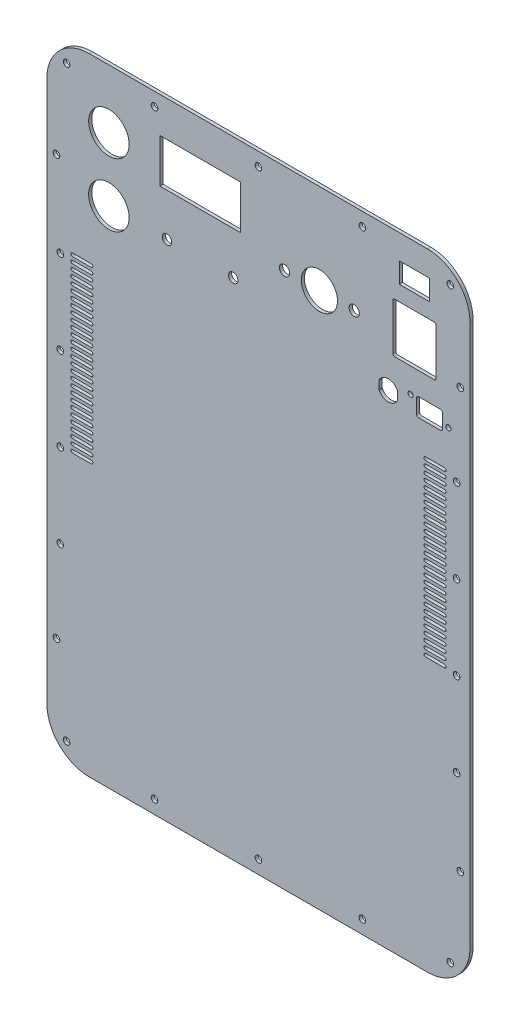
from build123d import *

# Parameters (mm, degrees)
SALIENTE_EXTRUIR1_DEPTH = 2
CROQUIS2_R              = 12.85
CROQUIS2_R_2            = 3
CROQUIS2_R_3            = 11.5
CROQUIS2_R_4            = 3.25
CROQUIS2_R_5            = 1.625
CROQUIS2_W              = 51.3
CROQUIS2_H              = 27.8
CROQUIS2_W_2            = 19.3
CROQUIS2_H_2            = 12.9
CORTAR_EXTRUIR1_DEPTH   = 240.926161819
CROQUIS3_R              = 2.095
CORTAR_EXTRUIR2_DEPTH   = 240.926161819
CORTAR_EXTRUIR3_DEPTH   = 240.926161819


with BuildPart() as part:
    # Croquis1 → Saliente-Extruir1 (new body)
    with BuildSketch(Plane.XY):
        with BuildLine():
            Line((-107.295, -198.81), (107.295, -198.81))
            ThreePointArc((107.295, -198.81), (126.386883092, -190.901883092), (134.295, -171.81))
            Line((134.295, -171.81), (134.295, 171.81))
            ThreePointArc((134.295, 171.81), (126.386883092, 190.901883092), (107.295, 198.81))
            Line((107.295, 198.81), (-107.295, 198.81))
            ThreePointArc((-107.295, 198.81), (-126.386883092, 190.901883092), (-134.295, 171.81))
            Line((-134.295, 171.81), (-134.295, -171.81))
            ThreePointArc((-134.295, -171.81), (-126.386883092, -190.901883092), (-107.295, -198.81))
        make_face()
    extrude(amount=SALIENTE_EXTRUIR1_DEPTH)

    # Croquis2 → Cortar-Extruir1 (cut, through all)
    with BuildSketch(Plane.XY.offset(2)):
        with Locations((-94.915, 161.54)):
            Circle(CROQUIS2_R)
        with Locations((-94.915, 121.27)):
            Circle(CROQUIS2_R)
        with Locations((-58.015, 121.27)):
            Circle(CROQUIS2_R_2)
        with Locations((-16.015, 121.27)):
            Circle(CROQUIS2_R_2)
        with Locations((38.695, 141.62)):
            Circle(CROQUIS2_R_3)
        with Locations((16.595, 141.62)):
            Circle(CROQUIS2_R_4)
        with Locations((60.795, 141.62)):
            Circle(CROQUIS2_R_4)
        with Locations((120.565, 107.09)):
            Circle(CROQUIS2_R_5)
        with Locations((96.565, 113.44)):
            Circle(CROQUIS2_R_5)
        with Locations((-36.965, 162.29)):
            Rectangle(CROQUIS2_W, CROQUIS2_H)
        with Locations((99.035, 176.84)):
            Rectangle(CROQUIS2_W_2, CROQUIS2_H_2)
        with BuildLine():
            Line((86.385, 129.09), (111.685, 129.09))
            ThreePointArc((111.685, 129.09), (112.392106781, 129.382893219), (112.685, 130.09))
            Line((112.685, 130.09), (112.685, 159.69))
            ThreePointArc((112.685, 159.69), (112.392106781, 160.397106781), (111.685, 160.69))
            Line((111.685, 160.69), (86.385, 160.69))
            ThreePointArc((86.385, 160.69), (85.677893219, 160.397106781), (85.385, 159.69))
            Line((85.385, 159.69), (85.385, 130.09))
            ThreePointArc((85.385, 130.09), (85.677893219, 129.382893219), (86.385, 129.09))
        make_face()
        with BuildLine():
            Line((101.67, 103.165), (115.46, 103.165))
            ThreePointArc((115.46, 103.165), (116.435807358, 103.569192642), (116.84, 104.545))
            Line((116.84, 104.545), (116.84, 113.335))
            ThreePointArc((116.84, 113.335), (116.435807358, 114.310807358), (115.46, 114.715))
            Line((115.46, 114.715), (101.67, 114.715))
            ThreePointArc((101.67, 114.715), (100.694192642, 114.310807358), (100.29, 113.335))
            Line((100.29, 113.335), (100.29, 104.545))
            ThreePointArc((100.29, 104.545), (100.694192642, 103.569192642), (101.67, 103.165))
        make_face()
        with BuildLine():
            Line((76.59, 105.938703148), (76.59, 111.241296852))
            ThreePointArc((76.59, 111.241296852), (82.415, 114.99), (88.24, 111.241296852))
            Line((88.24, 111.241296852), (88.24, 105.938703148))
            ThreePointArc((88.24, 105.938703148), (82.415, 102.19), (76.59, 105.938703148))
        make_face()
    extrude(amount=-CORTAR_EXTRUIR1_DEPTH, mode=Mode.SUBTRACT)

    # Croquis3 → Cortar-Extruir2 (cut, through all)
    with BuildSketch(Plane.XY.offset(2)):
        with Locations((0, 190.26)):
            Circle(CROQUIS3_R)
        with Locations((-65.96, 190.26)):
            Circle(CROQUIS3_R)
        with Locations((-121.78, 186.3)):
            Circle(CROQUIS3_R)
        with Locations(Location((65.96, 190.26, 0), (0, 0, 180))):
            Circle(CROQUIS3_R)
        with Locations(Location((121.78, 186.3, 0), (0, 0, 180))):
            Circle(CROQUIS3_R)
        with Locations((121.78, -186.3)):
            Circle(CROQUIS3_R)
        with Locations((65.96, -190.26)):
            Circle(CROQUIS3_R)
        with Locations(Location((0, -190.26, 0), (0, 0, 180))):
            Circle(CROQUIS3_R)
        with Locations(Location((-65.96, -190.26, 0), (0, 0, 180))):
            Circle(CROQUIS3_R)
        with Locations(Location((-121.78, -186.3, 0), (0, 0, 180))):
            Circle(CROQUIS3_R)
        with Locations((-125.745, 26.61)):
            Circle(CROQUIS3_R)
        with Locations((-125.745, 79.83)):
            Circle(CROQUIS3_R)
        with Locations((-128.165, 133.05)):
            Circle(CROQUIS3_R)
        with Locations(Location((-125.745, -26.61, 0), (0, 0, 180))):
            Circle(CROQUIS3_R)
        with Locations(Location((-125.745, -79.83, 0), (0, 0, 180))):
            Circle(CROQUIS3_R)
        with Locations(Location((-128.165, -133.05, 0), (0, 0, 180))):
            Circle(CROQUIS3_R)
        with Locations((128.165, -133.05)):
            Circle(CROQUIS3_R)
        with Locations((125.745, -79.83)):
            Circle(CROQUIS3_R)
        with Locations((125.745, -26.61)):
            Circle(CROQUIS3_R)
        with Locations(Location((125.745, 26.61, 0), (0, 0, 180))):
            Circle(CROQUIS3_R)
        with Locations(Location((125.745, 79.83, 0), (0, 0, 180))):
            Circle(CROQUIS3_R)
        with Locations(Location((128.165, 133.05, 0), (0, 0, 180))):
            Circle(CROQUIS3_R)
    extrude(amount=-CORTAR_EXTRUIR2_DEPTH, mode=Mode.SUBTRACT)

    # Croquis4 → Cortar-Extruir3 (cut, through all)
    with BuildSketch(Plane.XY.offset(2)):
        with BuildLine():
            Line((-118.065, 83.89), (-106.065, 83.89))
            ThreePointArc((-106.065, 83.89), (-105.065, 82.89), (-106.065, 81.89))
            Line((-106.065, 81.89), (-118.065, 81.89))
            ThreePointArc((-118.065, 81.89), (-119.065, 82.89), (-118.065, 83.89))
        make_face()
        with BuildLine():
            Line((-118.065, 79.89), (-106.065, 79.89))
            ThreePointArc((-106.065, 79.89), (-105.065, 78.89), (-106.065, 77.89))
            Line((-106.065, 77.89), (-118.065, 77.89))
            ThreePointArc((-118.065, 77.89), (-119.065, 78.89), (-118.065, 79.89))
        make_face()
        with BuildLine():
            Line((-118.065, 75.89), (-106.065, 75.89))
            ThreePointArc((-106.065, 75.89), (-105.065, 74.89), (-106.065, 73.89))
            Line((-106.065, 73.89), (-118.065, 73.89))
            ThreePointArc((-118.065, 73.89), (-119.065, 74.89), (-118.065, 75.89))
        make_face()
        with BuildLine():
            Line((-118.065, 71.89), (-106.065, 71.89))
            ThreePointArc((-106.065, 71.89), (-105.065, 70.89), (-106.065, 69.89))
            Line((-106.065, 69.89), (-118.065, 69.89))
            ThreePointArc((-118.065, 69.89), (-119.065, 70.89), (-118.065, 71.89))
        make_face()
        with BuildLine():
            Line((-118.065, 67.89), (-106.065, 67.89))
            ThreePointArc((-106.065, 67.89), (-105.065, 66.89), (-106.065, 65.89))
            Line((-106.065, 65.89), (-118.065, 65.89))
            ThreePointArc((-118.065, 65.89), (-119.065, 66.89), (-118.065, 67.89))
        make_face()
        with BuildLine():
            Line((-118.065, 63.89), (-106.065, 63.89))
            ThreePointArc((-106.065, 63.89), (-105.065, 62.89), (-106.065, 61.89))
            Line((-106.065, 61.89), (-118.065, 61.89))
            ThreePointArc((-118.065, 61.89), (-119.065, 62.89), (-118.065, 63.89))
        make_face()
        with BuildLine():
            Line((-118.065, 59.89), (-106.065, 59.89))
            ThreePointArc((-106.065, 59.89), (-105.065, 58.89), (-106.065, 57.89))
            Line((-106.065, 57.89), (-118.065, 57.89))
            ThreePointArc((-118.065, 57.89), (-119.065, 58.89), (-118.065, 59.89))
        make_face()
        with BuildLine():
            Line((-118.065, 55.89), (-106.065, 55.89))
            ThreePointArc((-106.065, 55.89), (-105.065, 54.89), (-106.065, 53.89))
            Line((-106.065, 53.89), (-118.065, 53.89))
            ThreePointArc((-118.065, 53.89), (-119.065, 54.89), (-118.065, 55.89))
        make_face()
        with BuildLine():
            Line((-118.065, 51.89), (-106.065, 51.89))
            ThreePointArc((-106.065, 51.89), (-105.065, 50.89), (-106.065, 49.89))
            Line((-106.065, 49.89), (-118.065, 49.89))
            ThreePointArc((-118.065, 49.89), (-119.065, 50.89), (-118.065, 51.89))
        make_face()
        with BuildLine():
            Line((-118.065, 47.89), (-106.065, 47.89))
            ThreePointArc((-106.065, 47.89), (-105.065, 46.89), (-106.065, 45.89))
            Line((-106.065, 45.89), (-118.065, 45.89))
            ThreePointArc((-118.065, 45.89), (-119.065, 46.89), (-118.065, 47.89))
        make_face()
        with BuildLine():
            Line((-118.065, 43.89), (-106.065, 43.89))
            ThreePointArc((-106.065, 43.89), (-105.065, 42.89), (-106.065, 41.89))
            Line((-106.065, 41.89), (-118.065, 41.89))
            ThreePointArc((-118.065, 41.89), (-119.065, 42.89), (-118.065, 43.89))
        make_face()
        with BuildLine():
            Line((-118.065, 39.89), (-106.065, 39.89))
            ThreePointArc((-106.065, 39.89), (-105.065, 38.89), (-106.065, 37.89))
            Line((-106.065, 37.89), (-118.065, 37.89))
            ThreePointArc((-118.065, 37.89), (-119.065, 38.89), (-118.065, 39.89))
        make_face()
        with BuildLine():
            Line((-118.065, 35.89), (-106.065, 35.89))
            ThreePointArc((-106.065, 35.89), (-105.065, 34.89), (-106.065, 33.89))
            Line((-106.065, 33.89), (-118.065, 33.89))
            ThreePointArc((-118.065, 33.89), (-119.065, 34.89), (-118.065, 35.89))
        make_face()
        with BuildLine():
            Line((-118.065, 31.89), (-106.065, 31.89))
            ThreePointArc((-106.065, 31.89), (-105.065, 30.89), (-106.065, 29.89))
            Line((-106.065, 29.89), (-118.065, 29.89))
            ThreePointArc((-118.065, 29.89), (-119.065, 30.89), (-118.065, 31.89))
        make_face()
        with BuildLine():
            Line((-118.065, 27.89), (-106.065, 27.89))
            ThreePointArc((-106.065, 27.89), (-105.065, 26.89), (-106.065, 25.89))
            Line((-106.065, 25.89), (-118.065, 25.89))
            ThreePointArc((-118.065, 25.89), (-119.065, 26.89), (-118.065, 27.89))
        make_face()
        with BuildLine():
            Line((-118.065, 23.89), (-106.065, 23.89))
            ThreePointArc((-106.065, 23.89), (-105.065, 22.89), (-106.065, 21.89))
            Line((-106.065, 21.89), (-118.065, 21.89))
            ThreePointArc((-118.065, 21.89), (-119.065, 22.89), (-118.065, 23.89))
        make_face()
        with BuildLine():
            Line((-118.065, 19.89), (-106.065, 19.89))
            ThreePointArc((-106.065, 19.89), (-105.065, 18.89), (-106.065, 17.89))
            Line((-106.065, 17.89), (-118.065, 17.89))
            ThreePointArc((-118.065, 17.89), (-119.065, 18.89), (-118.065, 19.89))
        make_face()
        with BuildLine():
            Line((-118.065, 15.89), (-106.065, 15.89))
            ThreePointArc((-106.065, 15.89), (-105.065, 14.89), (-106.065, 13.89))
            Line((-106.065, 13.89), (-118.065, 13.89))
            ThreePointArc((-118.065, 13.89), (-119.065, 14.89), (-118.065, 15.89))
        make_face()
        with BuildLine():
            Line((-118.065, 11.89), (-106.065, 11.89))
            ThreePointArc((-106.065, 11.89), (-105.065, 10.89), (-106.065, 9.89))
            Line((-106.065, 9.89), (-118.065, 9.89))
            ThreePointArc((-118.065, 9.89), (-119.065, 10.89), (-118.065, 11.89))
        make_face()
        with BuildLine():
            Line((-118.065, 7.89), (-106.065, 7.89))
            ThreePointArc((-106.065, 7.89), (-105.065, 6.89), (-106.065, 5.89))
            Line((-106.065, 5.89), (-118.065, 5.89))
            ThreePointArc((-118.065, 5.89), (-119.065, 6.89), (-118.065, 7.89))
        make_face()
        with BuildLine():
            Line((-118.065, 3.89), (-106.065, 3.89))
            ThreePointArc((-106.065, 3.89), (-105.065, 2.89), (-106.065, 1.89))
            Line((-106.065, 1.89), (-118.065, 1.89))
            ThreePointArc((-118.065, 1.89), (-119.065, 2.89), (-118.065, 3.89))
        make_face()
        with BuildLine():
            Line((-118.065, -0.11), (-106.065, -0.11))
            ThreePointArc((-106.065, -0.11), (-105.065, -1.11), (-106.065, -2.11))
            Line((-106.065, -2.11), (-118.065, -2.11))
            ThreePointArc((-118.065, -2.11), (-119.065, -1.11), (-118.065, -0.11))
        make_face()
        with BuildLine():
            Line((-118.065, -4.11), (-106.065, -4.11))
            ThreePointArc((-106.065, -4.11), (-105.065, -5.11), (-106.065, -6.11))
            Line((-106.065, -6.11), (-118.065, -6.11))
            ThreePointArc((-118.065, -6.11), (-119.065, -5.11), (-118.065, -4.11))
        make_face()
        with BuildLine():
            Line((-118.065, -8.11), (-106.065, -8.11))
            ThreePointArc((-106.065, -8.11), (-105.065, -9.11), (-106.065, -10.11))
            Line((-106.065, -10.11), (-118.065, -10.11))
            ThreePointArc((-118.065, -10.11), (-119.065, -9.11), (-118.065, -8.11))
        make_face()
        with BuildLine():
            Line((-118.065, -12.11), (-106.065, -12.11))
            ThreePointArc((-106.065, -12.11), (-105.065, -13.11), (-106.065, -14.11))
            Line((-106.065, -14.11), (-118.065, -14.11))
            ThreePointArc((-118.065, -14.11), (-119.065, -13.11), (-118.065, -12.11))
        make_face()
        with BuildLine():
            Line((-118.065, -16.11), (-106.065, -16.11))
            ThreePointArc((-106.065, -16.11), (-105.065, -17.11), (-106.065, -18.11))
            Line((-106.065, -18.11), (-118.065, -18.11))
            ThreePointArc((-118.065, -18.11), (-119.065, -17.11), (-118.065, -16.11))
        make_face()
        with BuildLine():
            Line((-118.065, -20.11), (-106.065, -20.11))
            ThreePointArc((-106.065, -20.11), (-105.065, -21.11), (-106.065, -22.11))
            Line((-106.065, -22.11), (-118.065, -22.11))
            ThreePointArc((-118.065, -22.11), (-119.065, -21.11), (-118.065, -20.11))
        make_face()
        with BuildLine():
            Line((-118.065, -24.11), (-106.065, -24.11))
            ThreePointArc((-106.065, -24.11), (-105.065, -25.11), (-106.065, -26.11))
            Line((-106.065, -26.11), (-118.065, -26.11))
            ThreePointArc((-118.065, -26.11), (-119.065, -25.11), (-118.065, -24.11))
        make_face()
        with BuildLine():
            Line((-150.525, 83.89), (-162.525, 83.89))
            ThreePointArc((-162.525, 83.89), (-163.525, 82.89), (-162.525, 81.89))
            Line((-162.525, 81.89), (-150.525, 81.89))
            ThreePointArc((-150.525, 81.89), (-149.525, 82.89), (-150.525, 83.89))
        make_face()
        with BuildLine():
            Line((118.065, -24.11), (106.065, -24.11))
            ThreePointArc((106.065, -24.11), (105.065, -25.11), (106.065, -26.11))
            Line((106.065, -26.11), (118.065, -26.11))
            ThreePointArc((118.065, -26.11), (119.065, -25.11), (118.065, -24.11))
        make_face()
        with BuildLine():
            Line((118.065, -20.11), (106.065, -20.11))
            ThreePointArc((106.065, -20.11), (105.065, -21.11), (106.065, -22.11))
            Line((106.065, -22.11), (118.065, -22.11))
            ThreePointArc((118.065, -22.11), (119.065, -21.11), (118.065, -20.11))
        make_face()
        with BuildLine():
            Line((118.065, -16.11), (106.065, -16.11))
            ThreePointArc((106.065, -16.11), (105.065, -17.11), (106.065, -18.11))
            Line((106.065, -18.11), (118.065, -18.11))
            ThreePointArc((118.065, -18.11), (119.065, -17.11), (118.065, -16.11))
        make_face()
        with BuildLine():
            Line((118.065, -12.11), (106.065, -12.11))
            ThreePointArc((106.065, -12.11), (105.065, -13.11), (106.065, -14.11))
            Line((106.065, -14.11), (118.065, -14.11))
            ThreePointArc((118.065, -14.11), (119.065, -13.11), (118.065, -12.11))
        make_face()
        with BuildLine():
            Line((118.065, -8.11), (106.065, -8.11))
            ThreePointArc((106.065, -8.11), (105.065, -9.11), (106.065, -10.11))
            Line((106.065, -10.11), (118.065, -10.11))
            ThreePointArc((118.065, -10.11), (119.065, -9.11), (118.065, -8.11))
        make_face()
        with BuildLine():
            Line((118.065, -4.11), (106.065, -4.11))
            ThreePointArc((106.065, -4.11), (105.065, -5.11), (106.065, -6.11))
            Line((106.065, -6.11), (118.065, -6.11))
            ThreePointArc((118.065, -6.11), (119.065, -5.11), (118.065, -4.11))
        make_face()
        with BuildLine():
            Line((118.065, -0.11), (106.065, -0.11))
            ThreePointArc((106.065, -0.11), (105.065, -1.11), (106.065, -2.11))
            Line((106.065, -2.11), (118.065, -2.11))
            ThreePointArc((118.065, -2.11), (119.065, -1.11), (118.065, -0.11))
        make_face()
        with BuildLine():
            Line((118.065, 3.89), (106.065, 3.89))
            ThreePointArc((106.065, 3.89), (105.065, 2.89), (106.065, 1.89))
            Line((106.065, 1.89), (118.065, 1.89))
            ThreePointArc((118.065, 1.89), (119.065, 2.89), (118.065, 3.89))
        make_face()
        with BuildLine():
            Line((118.065, 7.89), (106.065, 7.89))
            ThreePointArc((106.065, 7.89), (105.065, 6.89), (106.065, 5.89))
            Line((106.065, 5.89), (118.065, 5.89))
            ThreePointArc((118.065, 5.89), (119.065, 6.89), (118.065, 7.89))
        make_face()
        with BuildLine():
            Line((118.065, 11.89), (106.065, 11.89))
            ThreePointArc((106.065, 11.89), (105.065, 10.89), (106.065, 9.89))
            Line((106.065, 9.89), (118.065, 9.89))
            ThreePointArc((118.065, 9.89), (119.065, 10.89), (118.065, 11.89))
        make_face()
        with BuildLine():
            Line((118.065, 15.89), (106.065, 15.89))
            ThreePointArc((106.065, 15.89), (105.065, 14.89), (106.065, 13.89))
            Line((106.065, 13.89), (118.065, 13.89))
            ThreePointArc((118.065, 13.89), (119.065, 14.89), (118.065, 15.89))
        make_face()
        with BuildLine():
            Line((118.065, 19.89), (106.065, 19.89))
            ThreePointArc((106.065, 19.89), (105.065, 18.89), (106.065, 17.89))
            Line((106.065, 17.89), (118.065, 17.89))
            ThreePointArc((118.065, 17.89), (119.065, 18.89), (118.065, 19.89))
        make_face()
        with BuildLine():
            Line((118.065, 23.89), (106.065, 23.89))
            ThreePointArc((106.065, 23.89), (105.065, 22.89), (106.065, 21.89))
            Line((106.065, 21.89), (118.065, 21.89))
            ThreePointArc((118.065, 21.89), (119.065, 22.89), (118.065, 23.89))
        make_face()
        with BuildLine():
            Line((118.065, 27.89), (106.065, 27.89))
            ThreePointArc((106.065, 27.89), (105.065, 26.89), (106.065, 25.89))
            Line((106.065, 25.89), (118.065, 25.89))
            ThreePointArc((118.065, 25.89), (119.065, 26.89), (118.065, 27.89))
        make_face()
        with BuildLine():
            Line((118.065, 31.89), (106.065, 31.89))
            ThreePointArc((106.065, 31.89), (105.065, 30.89), (106.065, 29.89))
            Line((106.065, 29.89), (118.065, 29.89))
            ThreePointArc((118.065, 29.89), (119.065, 30.89), (118.065, 31.89))
        make_face()
        with BuildLine():
            Line((118.065, 35.89), (106.065, 35.89))
            ThreePointArc((106.065, 35.89), (105.065, 34.89), (106.065, 33.89))
            Line((106.065, 33.89), (118.065, 33.89))
            ThreePointArc((118.065, 33.89), (119.065, 34.89), (118.065, 35.89))
        make_face()
        with BuildLine():
            Line((118.065, 39.89), (106.065, 39.89))
            ThreePointArc((106.065, 39.89), (105.065, 38.89), (106.065, 37.89))
            Line((106.065, 37.89), (118.065, 37.89))
            ThreePointArc((118.065, 37.89), (119.065, 38.89), (118.065, 39.89))
        make_face()
        with BuildLine():
            Line((118.065, 43.89), (106.065, 43.89))
            ThreePointArc((106.065, 43.89), (105.065, 42.89), (106.065, 41.89))
            Line((106.065, 41.89), (118.065, 41.89))
            ThreePointArc((118.065, 41.89), (119.065, 42.89), (118.065, 43.89))
        make_face()
        with BuildLine():
            Line((118.065, 47.89), (106.065, 47.89))
            ThreePointArc((106.065, 47.89), (105.065, 46.89), (106.065, 45.89))
            Line((106.065, 45.89), (118.065, 45.89))
            ThreePointArc((118.065, 45.89), (119.065, 46.89), (118.065, 47.89))
        make_face()
        with BuildLine():
            Line((118.065, 51.89), (106.065, 51.89))
            ThreePointArc((106.065, 51.89), (105.065, 50.89), (106.065, 49.89))
            Line((106.065, 49.89), (118.065, 49.89))
            ThreePointArc((118.065, 49.89), (119.065, 50.89), (118.065, 51.89))
        make_face()
        with BuildLine():
            Line((118.065, 55.89), (106.065, 55.89))
            ThreePointArc((106.065, 55.89), (105.065, 54.89), (106.065, 53.89))
            Line((106.065, 53.89), (118.065, 53.89))
            ThreePointArc((118.065, 53.89), (119.065, 54.89), (118.065, 55.89))
        make_face()
        with BuildLine():
            Line((118.065, 59.89), (106.065, 59.89))
            ThreePointArc((106.065, 59.89), (105.065, 58.89), (106.065, 57.89))
            Line((106.065, 57.89), (118.065, 57.89))
            ThreePointArc((118.065, 57.89), (119.065, 58.89), (118.065, 59.89))
        make_face()
        with BuildLine():
            Line((118.065, 63.89), (106.065, 63.89))
            ThreePointArc((106.065, 63.89), (105.065, 62.89), (106.065, 61.89))
            Line((106.065, 61.89), (118.065, 61.89))
            ThreePointArc((118.065, 61.89), (119.065, 62.89), (118.065, 63.89))
        make_face()
        with BuildLine():
            Line((118.065, 67.89), (106.065, 67.89))
            ThreePointArc((106.065, 67.89), (105.065, 66.89), (106.065, 65.89))
            Line((106.065, 65.89), (118.065, 65.89))
            ThreePointArc((118.065, 65.89), (119.065, 66.89), (118.065, 67.89))
        make_face()
        with BuildLine():
            Line((118.065, 71.89), (106.065, 71.89))
            ThreePointArc((106.065, 71.89), (105.065, 70.89), (106.065, 69.89))
            Line((106.065, 69.89), (118.065, 69.89))
            ThreePointArc((118.065, 69.89), (119.065, 70.89), (118.065, 71.89))
        make_face()
        with BuildLine():
            Line((118.065, 75.89), (106.065, 75.89))
            ThreePointArc((106.065, 75.89), (105.065, 74.89), (106.065, 73.89))
            Line((106.065, 73.89), (118.065, 73.89))
            ThreePointArc((118.065, 73.89), (119.065, 74.89), (118.065, 75.89))
        make_face()
        with BuildLine():
            Line((118.065, 79.89), (106.065, 79.89))
            ThreePointArc((106.065, 79.89), (105.065, 78.89), (106.065, 77.89))
            Line((106.065, 77.89), (118.065, 77.89))
            ThreePointArc((118.065, 77.89), (119.065, 78.89), (118.065, 79.89))
        make_face()
        with BuildLine():
            Line((118.065, 83.89), (106.065, 83.89))
            ThreePointArc((106.065, 83.89), (105.065, 82.89), (106.065, 81.89))
            Line((106.065, 81.89), (118.065, 81.89))
            ThreePointArc((118.065, 81.89), (119.065, 82.89), (118.065, 83.89))
        make_face()
    extrude(amount=-CORTAR_EXTRUIR3_DEPTH, mode=Mode.SUBTRACT)


solid = part.part
